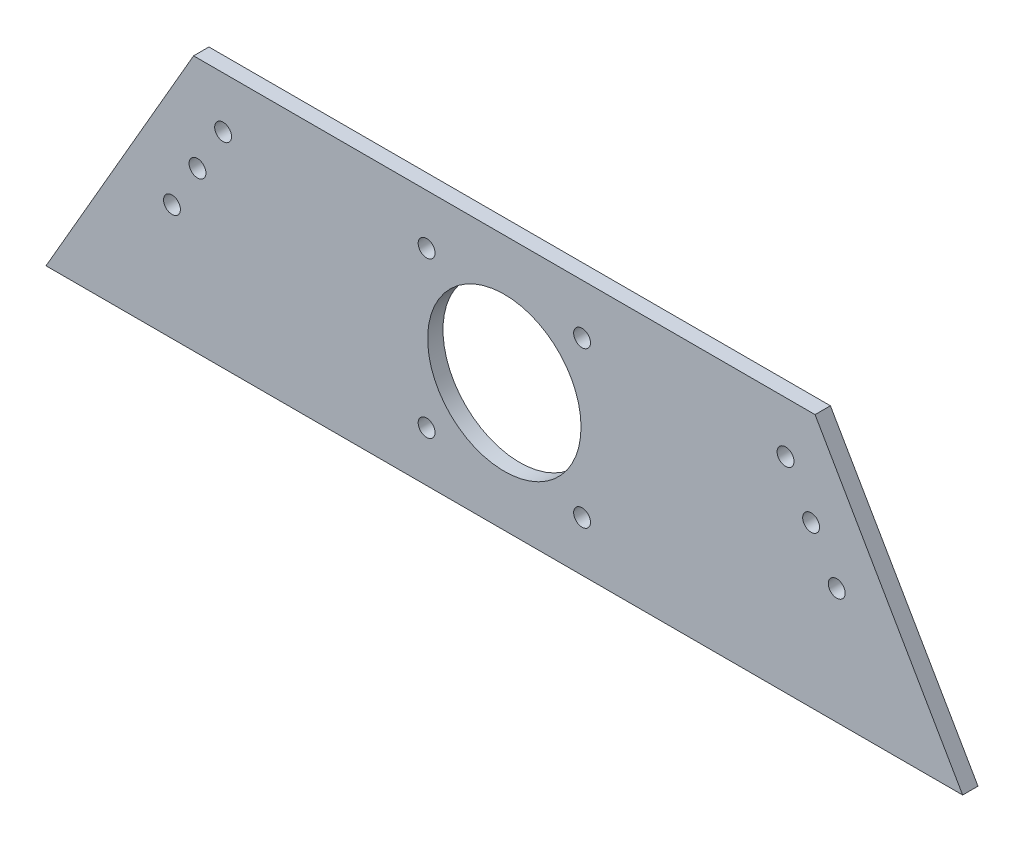
from build123d import *

# Parameters (mm, degrees)
SKETCH_1_W          = 130
SKETCH_1_H          = 20
SKETCH_1_R          = 1.65
EXTRUDE_1_DEPTH     = 3
SKETCH_2_W          = 130
SKETCH_2_H          = 30
EXTRUDE_2_DEPTH     = 3
SKETCH_3_R          = 15
SKETCH_3_R_2        = 1.65
CUT_EXTRUDE_1_DEPTH = 3
CUT_EXTRUDE_2_DEPTH = 3
EXTRUDE_3_DEPTH     = 3
SKETCH_6_R          = 1.65
CUT_EXTRUDE_3_DEPTH = 3


with BuildPart() as part:
    # 草图1 → 凸台-拉伸1 (new body)
    with BuildSketch(Plane.XY):
        Rectangle(SKETCH_1_W, SKETCH_1_H)
        with Locations((-55, 0)):
            Circle(SKETCH_1_R, mode=Mode.SUBTRACT)
        with Locations((55, 0)):
            Circle(SKETCH_1_R, mode=Mode.SUBTRACT)
    extrude(amount=EXTRUDE_1_DEPTH)

    # 草图2 → 凸台-拉伸2 (add)
    with BuildSketch(Plane.XY.offset(3)):
        with Locations((0, -25)):
            Rectangle(SKETCH_2_W, SKETCH_2_H)
    extrude(amount=-EXTRUDE_2_DEPTH)

    # 草图3 → 切除-拉伸1 (cut)
    with BuildSketch(Plane.XY):
        with Locations((0, -15)):
            Circle(SKETCH_3_R)
        with Locations((-15.202795796, 0.202795796)):
            Circle(SKETCH_3_R_2)
        with Locations(Location((-15.202795796, -30.202795796, 0), (0, 0, 180))):
            Circle(SKETCH_3_R_2)
        with Locations((15.202795796, -30.202795796)):
            Circle(SKETCH_3_R_2)
        with Locations(Location((15.202795796, 0.202795796, 0), (0, 0, 180))):
            Circle(SKETCH_3_R_2)
    extrude(amount=CUT_EXTRUDE_1_DEPTH, mode=Mode.SUBTRACT)

    # 草图4 → 切除-拉伸2 (cut)
    with BuildSketch(Plane.XY):
        Polygon((65, 10), (60.77, 10), (65, 2.673425084), align=None)
        Polygon((-65, 2.673425084), (-65, 10), (-60.77, 10), align=None)
    extrude(amount=CUT_EXTRUDE_2_DEPTH, mode=Mode.SUBTRACT)

    # 草图5 → 凸台-拉伸3 (add)
    with BuildSketch(Plane.XY.offset(3)):
        Polygon((-65, 2.673425084), (-89.637513459, -40), (-65, -40), align=None)
        Polygon((89.637513459, -40), (65, -40), (65, 2.673425084), align=None)
    extrude(amount=-EXTRUDE_3_DEPTH)

    # 草图6 → 切除-拉伸3 (cut)
    with BuildSketch(Plane(origin=(0, 0, 0), x_dir=(-1, 0, 0), z_dir=(0, 0, -1))):
        with Locations((-60, -8.660254038)):
            Circle(SKETCH_6_R)
        with Locations((-65, -17.320508076)):
            Circle(SKETCH_6_R)
        with Locations(Location((65, -17.320508076, 0), (0, 0, 180))):
            Circle(SKETCH_6_R)
        with Locations(Location((60, -8.660254038, 0), (0, 0, 180))):
            Circle(SKETCH_6_R)
    extrude(amount=-CUT_EXTRUDE_3_DEPTH, mode=Mode.SUBTRACT)


solid = part.part
